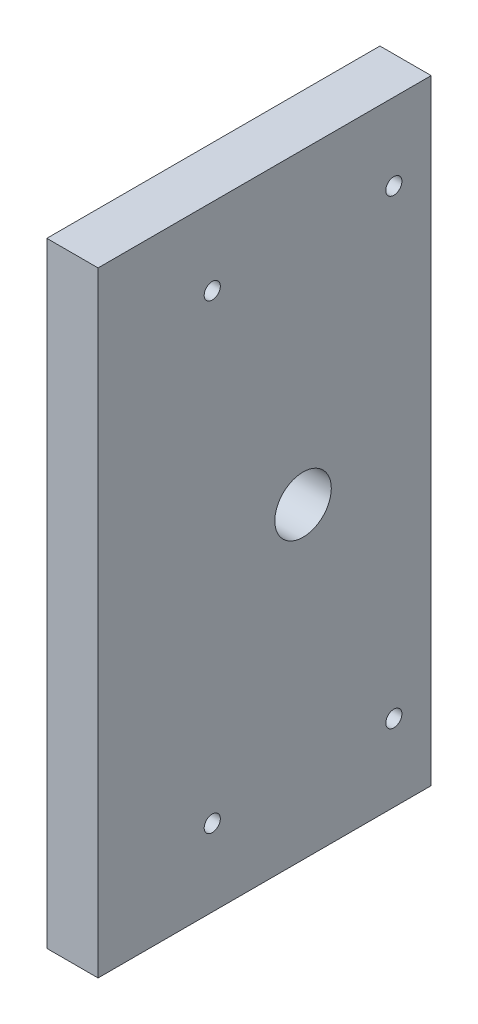
from build123d import *

# Parameters (mm, degrees)
ESQUISSE1_W             = 82.55
ESQUISSE1_H             = 152.4
BOSS_EXTRU_1_DEPTH      = 12.7
ESQUISSE2_R             = 2
ENL_V_MAT_EXTRU_1_DEPTH = 88.586275323
ESQUISSE3_R             = 7
ENL_V_MAT_EXTRU_2_DEPTH = 88.586275323
ESQUISSE5_R             = 7.5
ENL_V_MAT_EXTRU_4_DEPTH = 1


with BuildPart() as part:
    # Esquisse1 → Boss.-Extru.1 (new body)
    with BuildSketch(Plane(origin=(0, 0, 0), x_dir=(0, 0, -1), z_dir=(1, 0, 0))):
        Rectangle(ESQUISSE1_W, ESQUISSE1_H)
    extrude(amount=BOSS_EXTRU_1_DEPTH)

    # Esquisse2 → Enlèv. mat.-Extru.1 (cut, through all)
    with BuildSketch(Plane(origin=(12.7, 0, 0), x_dir=(0, 0, -1), z_dir=(1, 0, 0))):
        with Locations((-12.974999958, 57.15)):
            Circle(ESQUISSE2_R)
        with Locations((32.025000042, 57.15)):
            Circle(ESQUISSE2_R)
        with Locations((-12.974999958, -57.15)):
            Circle(ESQUISSE2_R)
        with Locations((32.025000042, -57.15)):
            Circle(ESQUISSE2_R)
    extrude(amount=-ENL_V_MAT_EXTRU_1_DEPTH, mode=Mode.SUBTRACT)

    # Esquisse3 → Enlèv. mat.-Extru.2 (cut, through all)
    with BuildSketch(Plane(origin=(12.7, 0, 0), x_dir=(0, 0, -1), z_dir=(1, 0, 0))):
        with Locations((9.525, 0)):
            Circle(ESQUISSE3_R)
    extrude(amount=-ENL_V_MAT_EXTRU_2_DEPTH, mode=Mode.SUBTRACT)

    # Esquisse5 → Enlèv. mat.-Extru.4 (cut)
    with BuildSketch(Plane.ZY):
        with Locations((-9.525, 0)):
            Circle(ESQUISSE5_R)
    extrude(amount=-ENL_V_MAT_EXTRU_4_DEPTH, mode=Mode.SUBTRACT)


solid = part.part
